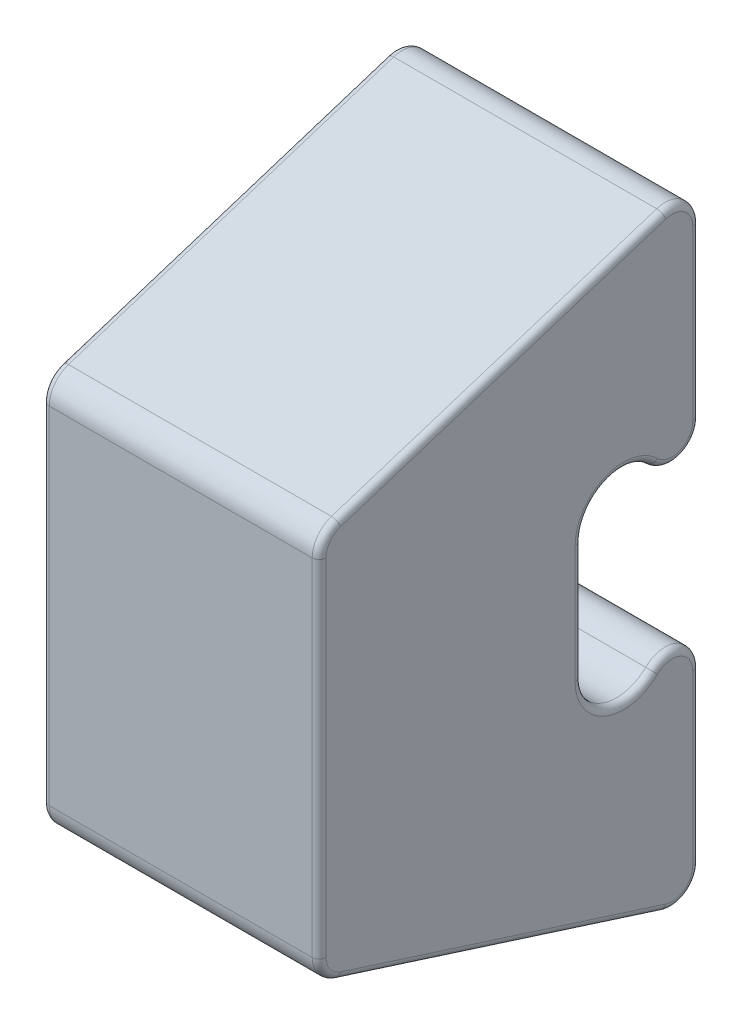
from build123d import *

# Parameters (mm, degrees)
BOSS_EXTRUDE1_DEPTH      = 1
BOSS_EXTRUDE1_DEPTH_BACK = 3
FILLET1_R                = 0.1


with BuildPart() as part:
    # Sketch3 → Boss-Extrude1 (new, two sides: drawn at the far end of the back side and taken through both)
    with BuildSketch(Plane.YZ.offset(-BOSS_EXTRUDE1_DEPTH_BACK)):
        with BuildLine():
            Line((-4, 5.4), (-1.56416825, 5.4))
            ThreePointArc((-1.56416825, 5.4), (-1.195386471, 5.645080666), (-1.278511113, 6.08))
            ThreePointArc((-1.278511113, 6.08), (-1.403198074, 6.732379001), (-0.850025407, 7.1))
            Line((-0.850025407, 7.1), (0.850025407, 7.1))
            ThreePointArc((0.850025407, 7.1), (1.403198074, 6.732379001), (1.278511113, 6.08))
            ThreePointArc((1.278511113, 6.08), (1.195386471, 5.645080666), (1.56416825, 5.4))
            Line((1.56416825, 5.4), (4, 5.4))
            ThreePointArc((4, 5.4), (4.322991043, 5.564040711), (4.381063684, 5.92161607))
            Line((4.381063684, 5.92161607), (2.881063684, 10.62161607))
            ThreePointArc((2.881063684, 10.62161607), (2.735959289, 10.822991043), (2.5, 10.9))
            Line((2.5, 10.9), (-2.5, 10.9))
            ThreePointArc((-2.5, 10.9), (-2.735959289, 10.822991043), (-2.881063684, 10.62161607))
            Line((-2.881063684, 10.62161607), (-4.381063684, 5.92161607))
            ThreePointArc((-4.381063684, 5.92161607), (-4.322991043, 5.564040711), (-4, 5.4))
        make_face()
    extrude(amount=BOSS_EXTRUDE1_DEPTH + BOSS_EXTRUDE1_DEPTH_BACK)

    # Fillet1
    fillet1_edges = [part.edges().sort_by_distance(p)[0] for p in [
        (-3, -1.195386471, 5.645080666),
        (-3, -1.403198074, 6.732379001),
        (-3, 0, 7.1),
        (-3, 1.403198074, 6.732379001),
        (-3, 1.195386471, 5.645080666),
        (-3, 2.782084125, 5.4),
        (-3, 4.322991043, 5.564040711),
        (1, -4.322991043, 5.564040711),
        (1, -2.782084125, 5.4),
        (1, -1.195386471, 5.645080666),
        (1, -1.403198074, 6.732379001),
        (-3, 3.631063684, 8.27161607),
        (1, 0, 7.1),
        (1, 1.403198074, 6.732379001),
        (1, 1.195386471, 5.645080666),
        (1, 2.782084125, 5.4),
        (1, 4.322991043, 5.564040711),
        (1, 3.631063684, 8.27161607),
        (1, 2.735959289, 10.822991043),
        (1, 0, 10.9),
        (1, -2.735959289, 10.822991043),
        (1, -3.631063684, 8.27161607),
        (-3, 2.735959289, 10.822991043),
        (-3, 0, 10.9),
        (-3, -4.322991043, 5.564040711),
        (-3, -2.735959289, 10.822991043),
        (-3, -3.631063684, 8.27161607),
        (-3, -2.782084125, 5.4),
    ]]
    fillet(fillet1_edges, radius=FILLET1_R)


solid = part.part
